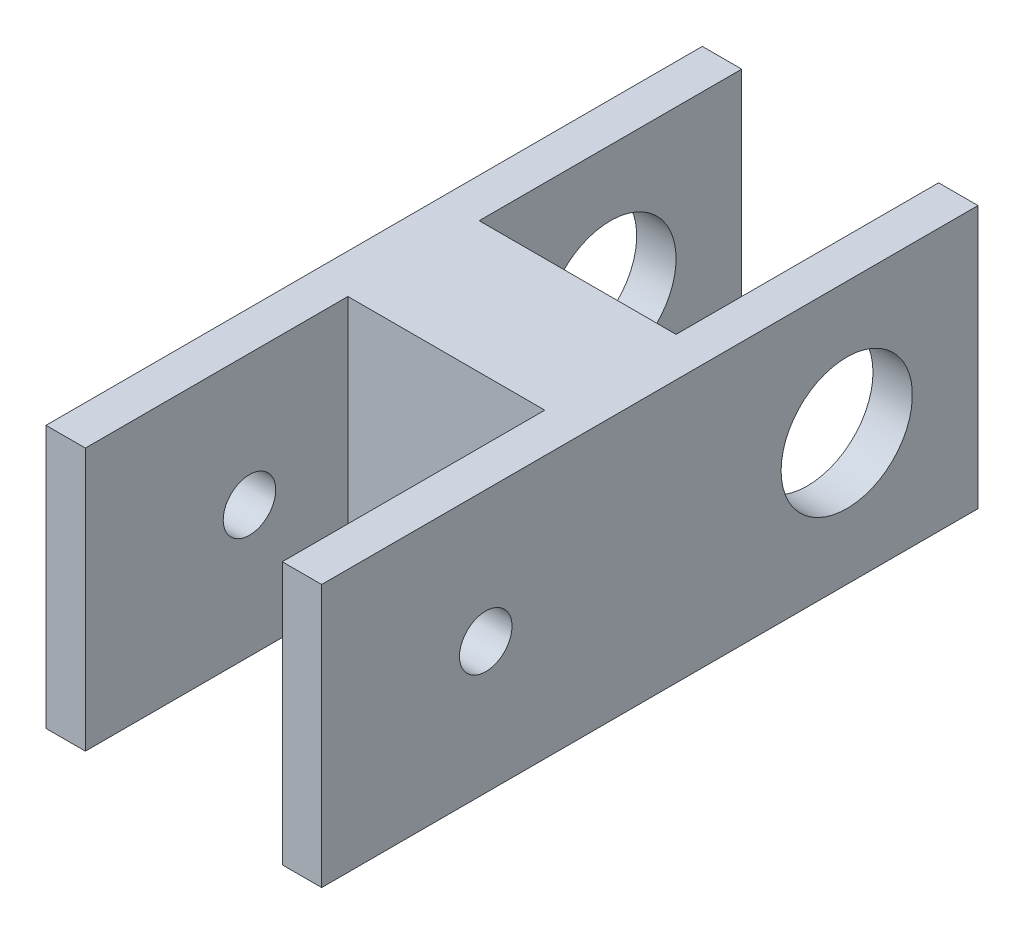
from build123d import *

# Parameters (mm, degrees)
BOSS_EXTRUDE1_DEPTH = 200
SKETCH4_R           = 20
SKETCH4_R_2         = 50
CUT_EXTRUDE1_DEPTH  = 313
SCALE1_SCALE        = 0.75


with BuildPart() as part:
    # Sketch1 → Boss-Extrude1 (new body)
    with BuildSketch(Plane(origin=(0, 0, 0), x_dir=(1, 0, 0), z_dir=(0, 1, 0))):
        Polygon((75, -250), (105, -250), (105, 250), (75, 250), (75, 50), (-75, 50), (-75, 250), (-105, 250), (-105, -250), (-75, -250), (-75, -50), (75, -50), align=None)
    extrude(amount=BOSS_EXTRUDE1_DEPTH)

    # Sketch4 → Cut-Extrude1 (cut)
    with BuildSketch(Plane.ZY.offset(105)):
        with Locations((125, 100)):
            Circle(SKETCH4_R)
        with Locations((-150, 100)):
            Circle(SKETCH4_R_2)
    extrude(amount=-CUT_EXTRUDE1_DEPTH, mode=Mode.SUBTRACT)


with BuildPart() as part_1:
    # Scale1: scaled about (0, 100, 7.246945107)
    add(part.part.scale(SCALE1_SCALE).moved(Location((0, 25, 1.811736277))))


solid = part_1.part
